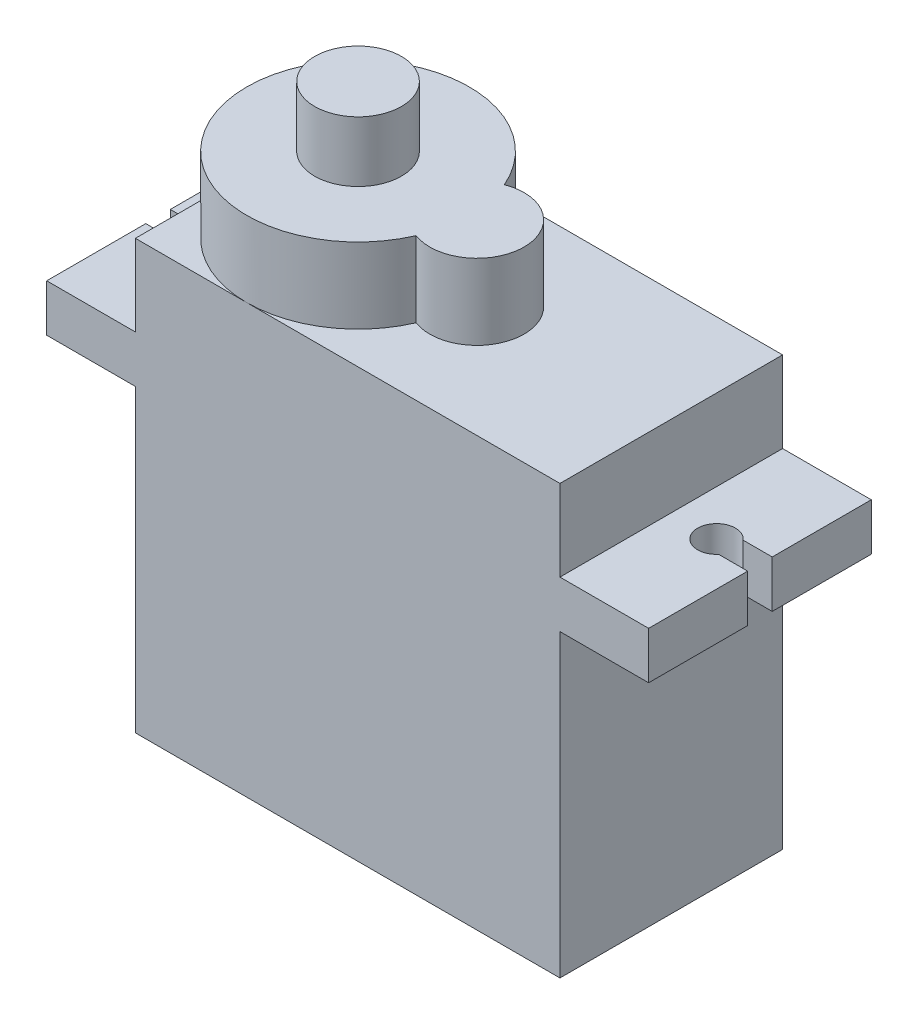
from build123d import *

# Parameters (mm, degrees)
SKETCH1_W           = 22.5
SKETCH1_H           = 11.8
BOSS_EXTRUDE1_DEPTH = 22.7
BOSS_EXTRUDE2_START = 15.9
SKETCH2_W           = 31.9
SKETCH2_H           = 11.8
BOSS_EXTRUDE2_DEPTH = 2.5
CUT_EXTRUDE1_DEPTH  = 26.055388642
SKETCH4_R           = 2.3
BOSS_EXTRUDE3_DEPTH = 4
SKETCH4_3_R         = 2.3
BOSS_EXTRUDE4_DEPTH = 7.2
SKETCH5_W           = 3.6
SKETCH5_H           = 1.2
CUT_EXTRUDE2_DEPTH  = 4


with BuildPart() as part:
    # Sketch1 → Boss-Extrude1 (new body)
    with BuildSketch(Plane(origin=(0, 0, 0), x_dir=(1, 0, 0), z_dir=(0, 1, 0))):
        Rectangle(SKETCH1_W, SKETCH1_H)
    extrude(amount=BOSS_EXTRUDE1_DEPTH)

    # Sketch2 → Boss-Extrude2 (add)
    with BuildSketch(Plane(origin=(0, 0, 0), x_dir=(1, 0, 0), z_dir=(0, 1, 0)).offset(BOSS_EXTRUDE2_START)):
        Rectangle(SKETCH2_W, SKETCH2_H)
    extrude(amount=BOSS_EXTRUDE2_DEPTH)

    # Sketch3 → Cut-Extrude1 (cut, through all)
    with BuildSketch(Plane(origin=(0, 18.4, 0), x_dir=(1, 0, 0), z_dir=(0, 1, 0))):
        with BuildLine():
            Line((-14.409934208, 0.65), (-15.95, 0.65))
            Line((-15.95, 0.65), (-15.95, -0.65))
            Line((-15.95, -0.65), (-14.409934208, -0.65))
            ThreePointArc((-14.409934208, -0.65), (-12.65, 0), (-14.409934208, 0.65))
        make_face()
        with BuildLine():
            Line((14.409934208, -0.65), (15.95, -0.65))
            Line((15.95, -0.65), (15.95, 0.65))
            Line((15.95, 0.65), (14.409934208, 0.65))
            ThreePointArc((14.409934208, 0.65), (12.65, 0), (14.409934208, -0.65))
        make_face()
    extrude(amount=-CUT_EXTRUDE1_DEPTH, mode=Mode.SUBTRACT)

    # Sketch4 → Boss-Extrude3 (add)
    with BuildSketch(Plane(origin=(0, 22.7, 0), x_dir=(1, 0, 0), z_dir=(0, 1, 0))):
        with BuildLine():
            ThreePointArc((0.066666667, 2.338743727), (-11.25, 0), (0.066666667, -2.338743727))
            ThreePointArc((0.066666667, -2.338743727), (3.45, 0), (0.066666667, 2.338743727))
        make_face()
        with Locations((-5.35, 0)):
            Circle(SKETCH4_R, mode=Mode.SUBTRACT)
    extrude(amount=BOSS_EXTRUDE3_DEPTH)

    # Sketch4<3> → Boss-Extrude4 (add)
    with BuildSketch(Plane(origin=(0, 22.7, 0), x_dir=(1, 0, 0), z_dir=(0, 1, 0))):
        with Locations((-5.35, 0)):
            Circle(SKETCH4_3_R)
    extrude(amount=BOSS_EXTRUDE4_DEPTH)

    # Sketch5 → Cut-Extrude2 (cut)
    with BuildSketch(Plane.ZY.offset(11.25)):
        with Locations((0, 5.1)):
            Rectangle(SKETCH5_W, SKETCH5_H)
    extrude(amount=-CUT_EXTRUDE2_DEPTH, mode=Mode.SUBTRACT)


solid = part.part
